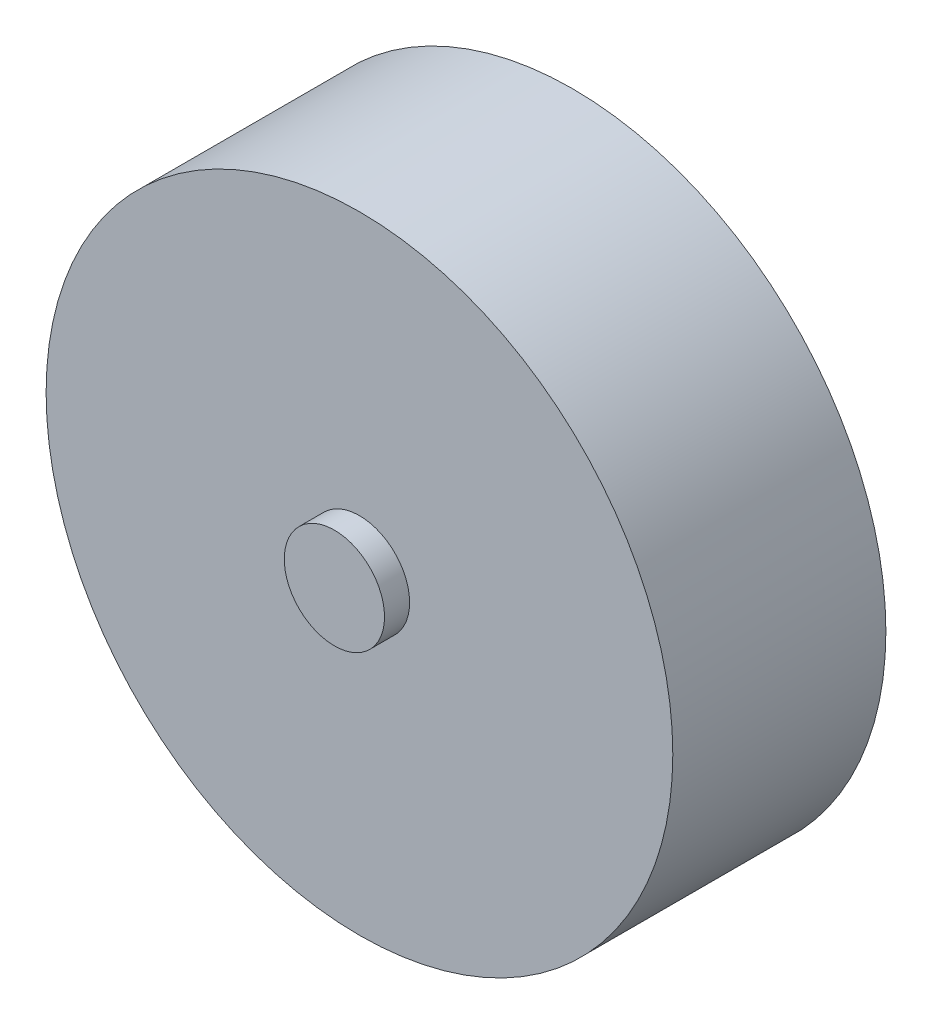
from build123d import *

# Parameters (mm, degrees)
SKETCH1_R                = 250
BOSS_EXTRUDE1_DEPTH      = 170
BOSS_EXTRUDE2_DEPTH      = 20
BOSS_EXTRUDE2_DEPTH_BACK = 190
SKETCH2_R                = 40


with BuildPart() as part:
    # Sketch1 → Boss-Extrude1 (new body)
    with BuildSketch(Plane.XY):
        Circle(SKETCH1_R)
    extrude(amount=BOSS_EXTRUDE1_DEPTH)

    # Sketch2 → Boss-Extrude2 (add, two sides: drawn at the far end of the back side and taken through both)
    with BuildSketch(Plane.XY.offset(170).offset(-BOSS_EXTRUDE2_DEPTH_BACK)):
        Circle(SKETCH2_R)
    extrude(amount=BOSS_EXTRUDE2_DEPTH + BOSS_EXTRUDE2_DEPTH_BACK)


solid = part.part
